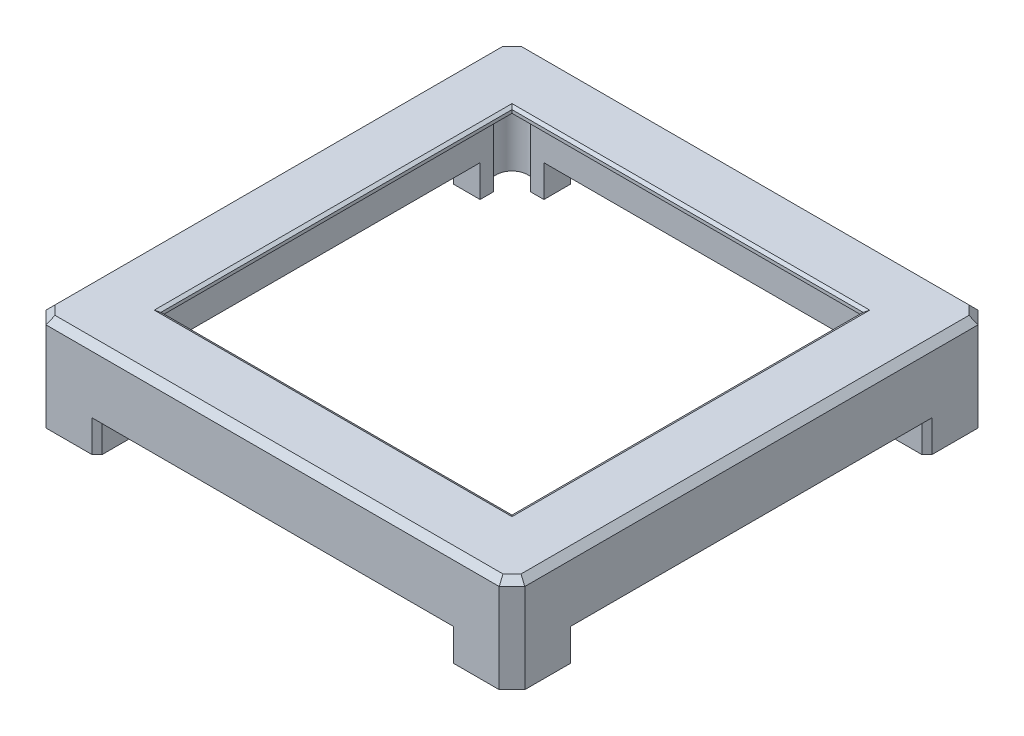
from build123d import *
from OCP.BRepFilletAPI import BRepFilletAPI_MakeChamfer

# Parameters (mm, degrees)
SKETCH1_W               = 95.25
SKETCH1_H               = 95.25
BOSS_EXTRUDE1_DEPTH     = 19.05
CUT_EXTRUDE1_DEPTH      = 6.35
LEGS_OUTER_SIZE         = 2.54
TOP_FACE_SIZE           = 1.27
LEGS_INNER_SIZE         = 1.016
CUT_EXTRUDE5_DEPTH      = 69.538830235
CUT_EXTRUDE5_DEPTH_BACK = 11.684
SKETCH6_W               = 82.55
SKETCH6_H               = 82.55
SKETCH3_3_W             = 69.85
SKETCH3_3_H             = 69.85
CUT_EXTRUDE6_DEPTH      = 70.9941694
CHAMFER3_SIZE           = 0.381
CHAMFER3_SIZE2          = 0.659911358
CUT_EXTRUDE3_DEPTH      = 18.034


with BuildPart() as part:
    # Sketch1 → Boss-Extrude1 (new body)
    with BuildSketch(Plane(origin=(0, 0, 0), x_dir=(1, 0, 0), z_dir=(0, 1, 0))):
        Rectangle(SKETCH1_W, SKETCH1_H)
    extrude(amount=BOSS_EXTRUDE1_DEPTH)

    # Sketch1<3> → Cut-Extrude1 (cut)
    with BuildSketch(Plane(origin=(0, 0, 0), x_dir=(1, 0, 0), z_dir=(0, 1, 0))):
        Polygon((-47.625, -34.925), (-34.925, -34.925), (-34.925, -47.625), (34.925, -47.625), (34.925, -34.925), (47.625, -34.925), (47.625, 34.925), (34.925, 34.925), (34.925, 47.625), (-34.925, 47.625), (-34.925, 34.925), (-47.625, 34.925), align=None)
    extrude(amount=CUT_EXTRUDE1_DEPTH, mode=Mode.SUBTRACT)

    # legs, outer
    legs_outer_edges = [part.edges().sort_by_distance(p)[0] for p in [
        (-47.625, 9.525, 47.625),
        (47.625, 9.525, 47.625),
        (47.625, 9.525, -47.625),
        (-47.625, 9.525, -47.625),
    ]]
    chamfer(legs_outer_edges, length=LEGS_OUTER_SIZE)

    # top face
    top_face_edges = [part.edges().sort_by_distance(p)[0] for p in [
        (0, 19.05, -47.625),
        (47.625, 19.05, 0),
        (-47.625, 19.05, 0),
        (0, 19.05, 47.625),
        (-46.355, 19.05, -46.355),
        (-46.355, 19.05, 46.355),
        (46.355, 19.05, 46.355),
        (46.355, 19.05, -46.355),
    ]]
    chamfer(top_face_edges, length=TOP_FACE_SIZE)

    # legs, inner
    legs_inner_edges = [part.edges().sort_by_distance(p)[0] for p in [
        (-47.625, 3.175, 34.925),
        (-47.625, 3.175, -34.925),
        (-34.925, 3.175, -47.625),
        (34.925, 3.175, -47.625),
        (47.625, 3.175, -34.925),
        (47.625, 3.175, 34.925),
        (34.925, 3.175, 47.625),
        (-34.925, 3.175, 47.625),
    ]]
    chamfer(legs_inner_edges, length=LEGS_INNER_SIZE)

    # Sketch6 → Cut-Extrude5 (cut, two sides: drawn at the far end of the back side and taken through both)
    with BuildSketch(Plane.XZ.offset(-6.35).offset(-CUT_EXTRUDE5_DEPTH_BACK)):
        Rectangle(SKETCH6_W, SKETCH6_H)
    extrude(amount=CUT_EXTRUDE5_DEPTH + CUT_EXTRUDE5_DEPTH_BACK, mode=Mode.SUBTRACT)

    # Sketch3<3> → Cut-Extrude6 (cut, through all)
    with BuildSketch(Plane(origin=(0, 0, 0), x_dir=(1, 0, 0), z_dir=(0, 1, 0))):
        Rectangle(SKETCH3_3_W, SKETCH3_3_H)
    extrude(amount=CUT_EXTRUDE6_DEPTH, mode=Mode.SUBTRACT)

    # Chamfer3: one chamfer whose edges measure the first distance from different faces: ONE call of the kernel's chamfer builder (chamfer() names one face for all edges)
    chamfer3_edges_1 = [part.edges().sort_by_distance(p)[0] for p in [
        (34.925, 19.05, 0),
    ]]
    chamfer3_side_1 = [part.faces().sort_by_distance(p)[0] for p in [
        (34.925, 18.542, 0),
    ]]
    chamfer3_edges_2 = [part.edges().sort_by_distance(p)[0] for p in [
        (0, 19.05, -34.925),
    ]]
    chamfer3_side_2 = [part.faces().sort_by_distance(p)[0] for p in [
        (0, 18.542, -34.925),
    ]]
    chamfer3_edges_3 = [part.edges().sort_by_distance(p)[0] for p in [
        (-34.925, 19.05, 0),
    ]]
    chamfer3_side_3 = [part.faces().sort_by_distance(p)[0] for p in [
        (-34.925, 18.542, 0),
    ]]
    chamfer3_edges_4 = [part.edges().sort_by_distance(p)[0] for p in [
        (0, 19.05, 34.925),
    ]]
    chamfer3_side_4 = [part.faces().sort_by_distance(p)[0] for p in [
        (0, 18.542, 34.925),
    ]]
    chamfer3 = BRepFilletAPI_MakeChamfer(part.part.solid().wrapped)
    for e in chamfer3_edges_1:
        chamfer3.Add(CHAMFER3_SIZE, CHAMFER3_SIZE2, e.wrapped, chamfer3_side_1[0].wrapped)  # the first distance lies on this face
    for e in chamfer3_edges_2:
        chamfer3.Add(CHAMFER3_SIZE, CHAMFER3_SIZE2, e.wrapped, chamfer3_side_2[0].wrapped)  # the first distance lies on this face
    for e in chamfer3_edges_3:
        chamfer3.Add(CHAMFER3_SIZE, CHAMFER3_SIZE2, e.wrapped, chamfer3_side_3[0].wrapped)  # the first distance lies on this face
    for e in chamfer3_edges_4:
        chamfer3.Add(CHAMFER3_SIZE, CHAMFER3_SIZE2, e.wrapped, chamfer3_side_4[0].wrapped)  # the first distance lies on this face
    add(Compound.cast(chamfer3.Shape()), mode=Mode.REPLACE)

    # Sketch3 → Cut-Extrude3 (cut)
    with BuildSketch(Plane(origin=(0, 0, 0), x_dir=(1, 0, 0), z_dir=(0, 1, 0))):
        with BuildLine():
            ThreePointArc((37.592, 40.767), (38.52193597, 38.52193597), (40.767, 37.592))
            Line((40.767, 37.592), (40.767, 40.767))
            Line((40.767, 40.767), (37.592, 40.767))
        make_face()
        with BuildLine():
            Line((40.767, 40.767), (40.767, 37.592))
            ThreePointArc((40.767, 37.592), (43.01206403, 38.52193597), (43.942, 40.767))
            ThreePointArc((43.942, 40.767), (40.767, 43.942), (37.592, 40.767))
            Line((37.592, 40.767), (40.767, 40.767))
        make_face()
        with BuildLine():
            ThreePointArc((-37.592, 40.767), (-43.01206403, 43.01206403), (-40.767, 37.592))
            Line((-40.767, 37.592), (-40.767, 40.767))
            Line((-40.767, 40.767), (-37.592, 40.767))
        make_face()
        with BuildLine():
            Line((-40.767, 40.767), (-40.767, 37.592))
            ThreePointArc((-40.767, 37.592), (-38.52193597, 38.52193597), (-37.592, 40.767))
            Line((-37.592, 40.767), (-40.767, 40.767))
        make_face()
        with BuildLine():
            ThreePointArc((40.767, -37.592), (38.52193597, -38.52193597), (37.592, -40.767))
            Line((37.592, -40.767), (40.767, -40.767))
            Line((40.767, -40.767), (40.767, -37.592))
        make_face()
        with BuildLine():
            Line((40.767, -40.767), (37.592, -40.767))
            ThreePointArc((37.592, -40.767), (40.767, -43.942), (43.942, -40.767))
            ThreePointArc((43.942, -40.767), (43.01206403, -38.52193597), (40.767, -37.592))
            Line((40.767, -37.592), (40.767, -40.767))
        make_face()
        with BuildLine():
            Line((-40.767, -37.592), (-40.767, -40.767))
            Line((-40.767, -40.767), (-37.592, -40.767))
            ThreePointArc((-37.592, -40.767), (-38.52193597, -38.52193597), (-40.767, -37.592))
        make_face()
        with BuildLine():
            Line((-37.592, -40.767), (-40.767, -40.767))
            Line((-40.767, -40.767), (-40.767, -37.592))
            ThreePointArc((-40.767, -37.592), (-43.01206403, -43.01206403), (-37.592, -40.767))
        make_face()
    extrude(amount=CUT_EXTRUDE3_DEPTH, mode=Mode.SUBTRACT)


solid = part.part
